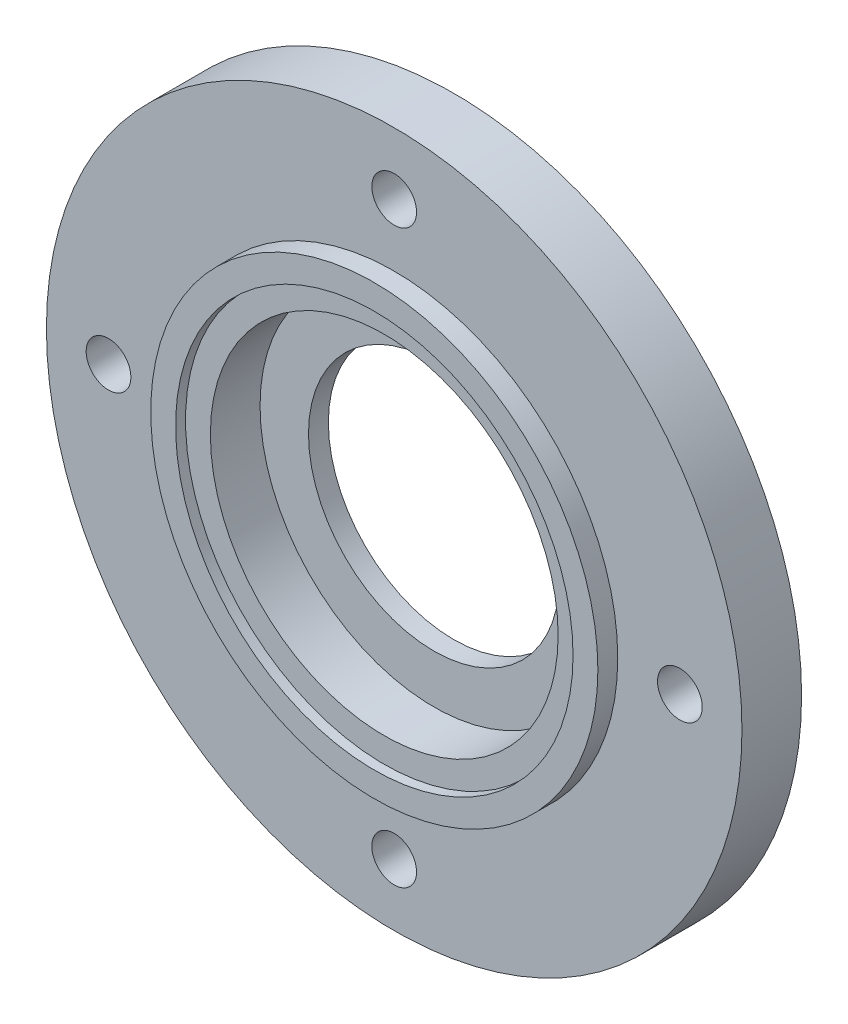
from build123d import *

# Parameters (mm, degrees)
SKETCH1_R           = 70
SKETCH1_R_2         = 4.5
BOSS_EXTRUDE1_DEPTH = 16
CUT_EXTRUDE1_START  = -4
SKETCH2_R           = 70
SKETCH2_R_2         = 45
CUT_EXTRUDE1_DEPTH  = 4
SKETCH3_R           = 40
CUT_EXTRUDE2_DEPTH  = 2
SKETCH4_R           = 25.25
CUT_EXTRUDE3_DEPTH  = 24
SKETCH7_R           = 35
CUT_EXTRUDE5_DEPTH  = 10


with BuildPart() as part:
    # Sketch1 → Boss-Extrude1 (new body)
    with BuildSketch(Plane.XY):
        Circle(SKETCH1_R)
        with Locations((0, 57.5)):
            Circle(SKETCH1_R_2, mode=Mode.SUBTRACT)
        with Locations((57.5, 0)):
            Circle(SKETCH1_R_2, mode=Mode.SUBTRACT)
        with Locations((0, -57.5)):
            Circle(SKETCH1_R_2, mode=Mode.SUBTRACT)
        with Locations((-57.5, 0)):
            Circle(SKETCH1_R_2, mode=Mode.SUBTRACT)
    extrude(amount=BOSS_EXTRUDE1_DEPTH)

    # Sketch2 → Cut-Extrude1 (cut)
    with BuildSketch(Plane.XY.offset(16).offset(CUT_EXTRUDE1_START)):
        Circle(SKETCH2_R)
        Circle(SKETCH2_R_2, mode=Mode.SUBTRACT)
    extrude(amount=CUT_EXTRUDE1_DEPTH, mode=Mode.SUBTRACT)

    # Sketch3 → Cut-Extrude2 (cut)
    with BuildSketch(Plane.XY.offset(16)):
        Circle(SKETCH3_R)
    extrude(amount=-CUT_EXTRUDE2_DEPTH, mode=Mode.SUBTRACT)

    # Sketch4 → Cut-Extrude3 (cut)
    with BuildSketch(Plane.XY.offset(14)):
        Circle(SKETCH4_R)
    extrude(amount=-CUT_EXTRUDE3_DEPTH, mode=Mode.SUBTRACT)

    # Sketch7 → Cut-Extrude5 (cut)
    with BuildSketch(Plane.XY.offset(14)):
        Circle(SKETCH7_R)
    extrude(amount=-CUT_EXTRUDE5_DEPTH, mode=Mode.SUBTRACT)


solid = part.part
